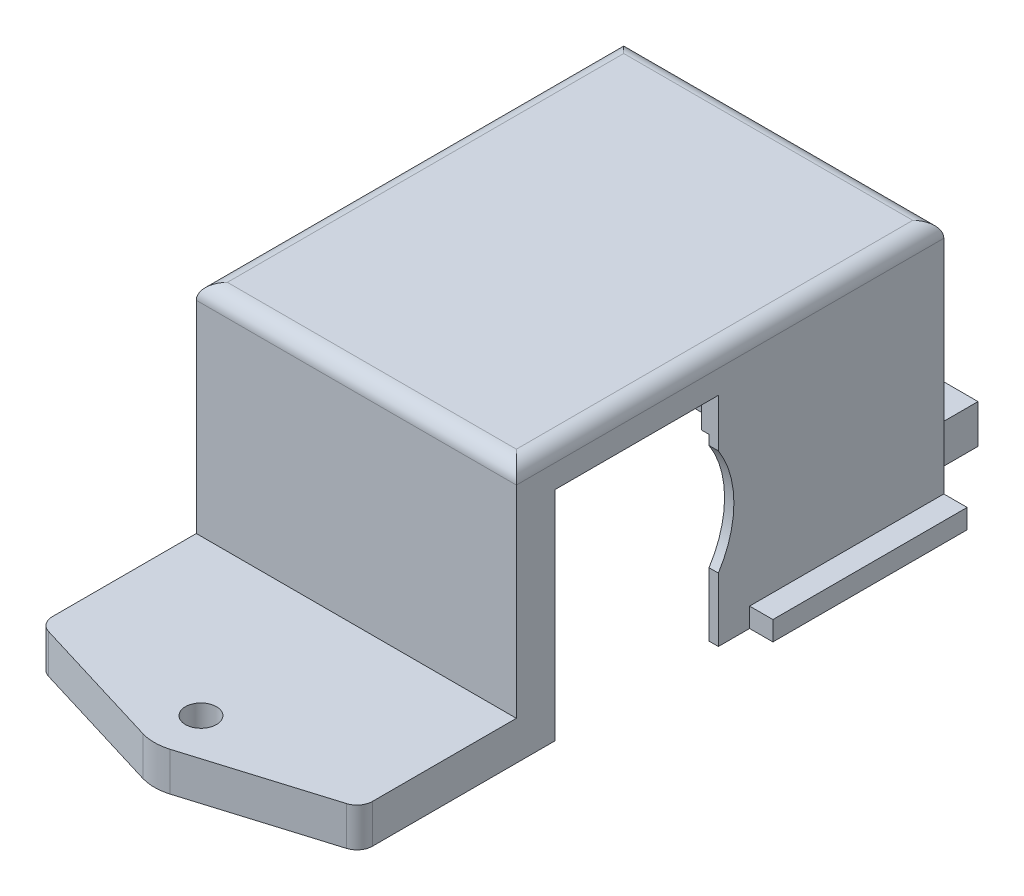
from build123d import *

# Parameters (mm, degrees)
SKETCH1_W            = 39
SKETCH1_H            = 49.22
BOSS_EXTRUDE2_DEPTH  = 30
SKETCH3_W            = 1.75
SKETCH3_H            = 20
SKETCH3_W_2          = 1
SKETCH3_H_2          = 15.1
CUT_EXTRUDE3_DEPTH   = 47.22
CUT_EXTRUDE4_DEPTH   = 47.22
CUT_EXTRUDE5_DEPTH   = 3.75
SKETCH9_W            = 22.2
SKETCH9_H            = 30
CUT_EXTRUDE7_DEPTH   = 61.922592565
SKETCH11_W           = 0.8
SKETCH11_H           = 21.811754546
SKETCH11_H_2         = 8.188245454
CUT_EXTRUDE8_DEPTH   = 46.008146799
SKETCH12_W           = 23
SKETCH12_H           = 2.5
BOSS_EXTRUDE3_DEPTH  = 3
SKETCH13_W           = 23
SKETCH13_H           = 2.5
BOSS_EXTRUDE4_DEPTH  = 3
BOSS_EXTRUDE5_REACH  = 51.909
SKETCH14_W           = 27.02
SKETCH14_H           = 3
SKETCH15_W           = 30.25
SKETCH15_H           = 3
CUT_EXTRUDE9_DEPTH   = 25.02
SKETCH16_W           = 30.25
SKETCH16_H           = 3
CUT_EXTRUDE10_DEPTH  = 46.276919382
SKETCH24_W           = 23
SKETCH24_H           = 2.5
BOSS_EXTRUDE8_DEPTH  = 6
BOSS_EXTRUDE9_DEPTH  = 3
SKETCH26_W           = 41.2
SKETCH26_H           = 27.02
BOSS_EXTRUDE10_DEPTH = 3
SKETCH29_W           = 4.264424859
SKETCH29_H           = 26.447816837
CUT_EXTRUDE14_DEPTH  = 41.905994632
SKETCH30_W           = 3.981396999
SKETCH30_H           = 33.655588154
CUT_EXTRUDE15_DEPTH  = 40.425282457
BOSS_EXTRUDE15_DEPTH = 2
BOSS_EXTRUDE16_DEPTH = 2
SKETCH36_W           = 41.2
SKETCH36_H           = 4.993514727
BOSS_EXTRUDE17_DEPTH = 26
SKETCH37_W           = 41.2
SKETCH37_H           = 5
BOSS_EXTRUDE18_DEPTH = 28.006485273
SKETCH38_W           = 41.2
SKETCH38_H           = 5
BOSS_EXTRUDE19_DEPTH = 20
BOSS_EXTRUDE21_DEPTH = 5
SKETCH40_R           = 2
CUT_EXTRUDE16_DEPTH  = 78.060934741
FILLET1_R            = 2
BOSS_EXTRUDE22_DEPTH = 10


with BuildPart() as part:
    # Sketch1 → Boss-Extrude2 (new body)
    with BuildSketch(Plane(origin=(0, 0, 0), x_dir=(1, 0, 0), z_dir=(0, 1, 0))):
        with Locations((-0.391025069, -11.314396792)):
            Rectangle(SKETCH1_W, SKETCH1_H)
    extrude(amount=BOSS_EXTRUDE2_DEPTH)

    # Sketch3 → Cut-Extrude3 (cut)
    with BuildSketch(Plane.XY.offset(35.924396792)):
        Polygon((16.108974931, 23.05), (16.108974931, 28), (-16.141025069, 28), (-16.141025069, 25.5), (-16.141025069, 5.5), (-16.141025069, 0), (16.108974931, 0), (16.108974931, 7.95), align=None)
        with Locations((-17.016025069, 15.5)):
            Rectangle(SKETCH3_W, SKETCH3_H)
        with Locations((16.608974931, 15.5)):
            Rectangle(SKETCH3_W_2, SKETCH3_H_2)
    extrude(amount=-CUT_EXTRUDE3_DEPTH, mode=Mode.SUBTRACT)

    # Sketch7 → Cut-Extrude4 (cut)
    with BuildSketch(Plane.ZY.offset(19.891025069)):
        with BuildLine():
            ThreePointArc((11.724396792, 15), (24.324396792, 2.4), (36.924396792, 15))
            ThreePointArc((36.924396792, 15), (24.324396792, 27.6), (11.724396792, 15))
        make_face()
    extrude(amount=-CUT_EXTRUDE4_DEPTH, mode=Mode.SUBTRACT)

    # Sketch8 → Cut-Extrude5 (cut)
    with BuildSketch(Plane.ZY.offset(19.891025069)):
        with BuildLine():
            Line((35.924396792, 30), (17.633933867, 30))
            Line((17.633933867, 30), (17.633933867, 27))
            Line((17.633933867, 27), (8.633933867, 27))
            Line((8.633933867, 27), (8.633933867, 4))
            Line((8.633933867, 4), (17.633933867, 4))
            Line((17.633933867, 4), (17.633933867, 0))
            Line((17.633933867, 0), (35.924396792, 0))
            Line((35.924396792, 0), (35.924396792, 10.08065045))
            ThreePointArc((35.924396792, 10.08065045), (11.724396792, 15), (35.924396792, 19.91934955))
            Line((35.924396792, 19.91934955), (35.924396792, 30))
        make_face()
    extrude(amount=-CUT_EXTRUDE5_DEPTH, mode=Mode.SUBTRACT)

    # Sketch9 → Cut-Extrude7 (cut, through all)
    with BuildSketch(Plane(origin=(19.108974931, 0, 0), x_dir=(0, 0, -1), z_dir=(1, 0, 0))):
        with Locations((-24.824396792, 15)):
            Rectangle(SKETCH9_W, SKETCH9_H)
    extrude(amount=-CUT_EXTRUDE7_DEPTH, mode=Mode.SUBTRACT)

    # Sketch11 → Cut-Extrude8 (cut, through all)
    with BuildSketch(Plane.XY.offset(13.724396792)):
        with Locations((18.708974931, 19.094122727)):
            Rectangle(SKETCH11_W, SKETCH11_H)
        with Locations((18.708974931, 4.094122727)):
            Rectangle(SKETCH11_W, SKETCH11_H_2)
    extrude(amount=-CUT_EXTRUDE8_DEPTH, mode=Mode.SUBTRACT)

    # Sketch12 → Boss-Extrude3 (add)
    with BuildSketch(Plane(origin=(18.308974931, 0, 0), x_dir=(0, 0, -1), z_dir=(1, 0, 0))):
        with Locations((1.795603208, 1.25)):
            Rectangle(SKETCH12_W, SKETCH12_H)
    extrude(amount=BOSS_EXTRUDE3_DEPTH)

    # Sketch13 → Boss-Extrude4 (add)
    with BuildSketch(Plane.ZY.offset(19.891025069)):
        with Locations((-1.795603208, 1.25)):
            Rectangle(SKETCH13_W, SKETCH13_H)
    extrude(amount=BOSS_EXTRUDE4_DEPTH)

    # Sketch14 → Boss-Extrude5 (add, up to next)
    with BuildSketch(Plane(origin=(-16.141025069, 0, 0), x_dir=(0, 0, -1), z_dir=(1, 0, 0)), mode=Mode.PRIVATE) as boss_extrude5_sk1:
        with Locations((-0.214396792, 1.5)):
            Rectangle(SKETCH14_W, SKETCH14_H)
    boss_extrude5_tool1 = extrude(boss_extrude5_sk1.sketch, amount=BOSS_EXTRUDE5_REACH, mode=Mode.PRIVATE) - part.part
    add(boss_extrude5_tool1.solids().sort_by_distance((-16.141025, 1.5, 0.214397))[0])

    # Sketch15 → Cut-Extrude9 (cut)
    with BuildSketch(Plane.XY.offset(13.724396792)):
        with Locations((-0.016025069, 1.5)):
            Rectangle(SKETCH15_W, SKETCH15_H)
    extrude(amount=-CUT_EXTRUDE9_DEPTH, mode=Mode.SUBTRACT)

    # Sketch16 → Cut-Extrude10 (cut, through all)
    with BuildSketch(Plane.XY.offset(-11.295603208)):
        with Locations((-0.016025069, 1.5)):
            Rectangle(SKETCH16_W, SKETCH16_H)
    extrude(amount=-CUT_EXTRUDE10_DEPTH, mode=Mode.SUBTRACT)

    # Sketch24 → Boss-Extrude8 (add)
    with BuildSketch(Plane.ZY.offset(22.891025069)):
        with Locations((-1.795603208, 1.25)):
            Rectangle(SKETCH24_W, SKETCH24_H)
    extrude(amount=BOSS_EXTRUDE8_DEPTH)

    # Sketch25 → Boss-Extrude9 (add)
    with BuildSketch(Plane.ZY.offset(19.891025069)):
        Polygon((-13.295603208, 30), (13.724396792, 30), (13.724396792, 27), (8.633933867, 27), (8.633933867, 4), (13.724396792, 4), (13.724396792, 0), (9.704396792, 0), (9.704396792, 2.5), (-13.295603208, 2.5), align=None)
    extrude(amount=BOSS_EXTRUDE9_DEPTH)

    # Sketch26 → Boss-Extrude10 (add)
    with BuildSketch(Plane(origin=(0, 30, 0), x_dir=(1, 0, 0), z_dir=(0, 1, 0))):
        with Locations((-2.291025069, -0.214396792)):
            Rectangle(SKETCH26_W, SKETCH26_H)
    extrude(amount=BOSS_EXTRUDE10_DEPTH)

    # Sketch29 → Cut-Extrude14 (cut, through all)
    with BuildSketch(Plane.XZ.offset(-25.5)):
        with Locations((-15.75881264, 1.92830521)):
            Rectangle(SKETCH29_W, SKETCH29_H)
    extrude(amount=CUT_EXTRUDE14_DEPTH, mode=Mode.SUBTRACT)

    # Sketch30 → Cut-Extrude15 (cut, through all)
    with BuildSketch(Plane(origin=(0, 23.05, 0), x_dir=(-1, 0, 0), z_dir=(0, -1, 0))):
        with Locations((-15.118276432, -5.532190869)):
            Rectangle(SKETCH30_W, SKETCH30_H)
    extrude(amount=CUT_EXTRUDE15_DEPTH, mode=Mode.SUBTRACT)

    # Sketch34 → Boss-Extrude15 (add)
    with BuildSketch(Plane(origin=(0, 0, -13.295603208), x_dir=(-1, 0, 0), z_dir=(0, 0, -1))):
        Polygon((-18.308974931, 33), (-18.308974931, 2.5), (-21.308974931, 2.5), (-21.308974931, 0), (28.891025069, 0), (28.891025069, 2.5), (22.891025069, 2.5), (22.891025069, 33), align=None)
    extrude(amount=-BOSS_EXTRUDE15_DEPTH)

    # Sketch35 → Boss-Extrude16 (add)
    with BuildSketch(Plane(origin=(0, 0, -13.295603208), x_dir=(-1, 0, 0), z_dir=(0, 0, -1))):
        Polygon((-18.308974931, 33), (-18.308974931, 2.5), (-21.308974931, 2.5), (-21.308974931, 0), (28.891025069, 0), (28.891025069, 2.5), (22.891025069, 2.5), (22.891025069, 33), align=None)
    extrude(amount=BOSS_EXTRUDE16_DEPTH)

    # Sketch36 → Boss-Extrude17 (add)
    with BuildSketch(Plane.XY.offset(13.724396792)):
        with Locations((-2.291025069, 30.503242637)):
            Rectangle(SKETCH36_W, SKETCH36_H)
    extrude(amount=BOSS_EXTRUDE17_DEPTH)

    # Sketch37 → Boss-Extrude18 (add)
    with BuildSketch(Plane(origin=(0, 28.006485273, 0), x_dir=(-1, 0, 0), z_dir=(0, -1, 0))):
        with Locations((2.291025069, -37.224396792)):
            Rectangle(SKETCH37_W, SKETCH37_H)
    extrude(amount=BOSS_EXTRUDE18_DEPTH)

    # Sketch38 → Boss-Extrude19 (add)
    with BuildSketch(Plane.XY.offset(39.724396792)):
        with Locations((-2.291025069, 2.5)):
            Rectangle(SKETCH38_W, SKETCH38_H)
    extrude(amount=BOSS_EXTRUDE19_DEPTH)

    # Sketch39 → Boss-Extrude21 (add)
    with BuildSketch(Plane(origin=(0, 5, 0), x_dir=(1, 0, 0), z_dir=(0, 1, 0))):
        with BuildLine():
            Line((-8.291025069, -59.724396792), (-22.891025069, -59.724396792))
            Line((-22.891025069, -59.724396792), (-4.038597885, -65.464256481))
            ThreePointArc((-4.038597885, -65.464256481), (-7.112095329, -63.296130482), (-8.291025069, -59.724396792))
        make_face()
        with BuildLine():
            ThreePointArc((-8.291025069, -59.724396792), (-7.112095329, -63.296130482), (-4.038597885, -65.464256481))
            ThreePointArc((-4.038597885, -65.464256481), (-2.291025069, -65.724396792), (-0.543452254, -65.464256481))
            ThreePointArc((-0.543452254, -65.464256481), (2.53004519, -63.296130482), (3.708974931, -59.724396792))
            Line((3.708974931, -59.724396792), (-0.291025069, -59.724396792))
            ThreePointArc((-0.291025069, -59.724396792), (-2.291025069, -61.724396792), (-4.291025069, -59.724396792))
            Line((-4.291025069, -59.724396792), (-8.291025069, -59.724396792))
        make_face()
        with BuildLine():
            ThreePointArc((3.708974931, -59.724396792), (-2.291025069, -53.724396792), (-8.291025069, -59.724396792))
            Line((-8.291025069, -59.724396792), (-4.291025069, -59.724396792))
            ThreePointArc((-4.291025069, -59.724396792), (-2.291025069, -57.724396792), (-0.291025069, -59.724396792))
            Line((-0.291025069, -59.724396792), (3.708974931, -59.724396792))
        make_face()
        with BuildLine():
            ThreePointArc((3.708974931, -59.724396792), (2.53004519, -63.296130482), (-0.543452254, -65.464256481))
            Line((-0.543452254, -65.464256481), (18.308974931, -59.724396792))
            Line((18.308974931, -59.724396792), (3.708974931, -59.724396792))
        make_face()
    extrude(amount=-BOSS_EXTRUDE21_DEPTH)

    # Sketch40 → Cut-Extrude16 (cut, through all)
    with BuildSketch(Plane(origin=(0, 5, 0), x_dir=(1, 0, 0), z_dir=(0, 1, 0))):
        with Locations(Location((-2.291025069, -59.724396792, 0), (0, 0, 270))):
            Circle(SKETCH40_R)
    extrude(amount=-CUT_EXTRUDE16_DEPTH, mode=Mode.SUBTRACT)

    # Fillet1
    fillet1_edges = [part.edges().sort_by_distance(p)[0] for p in [
        (-22.891025069, 33, 12.214396792),
        (18.308974931, 33, 12.214396792),
        (-2.291025069, 33, -15.295603208),
        (-2.291025069, 33, 39.724396792),
        (-22.891025069, 2.5, 59.724396792),
        (18.308974931, 2.5, 59.724396792),
    ]]
    fillet(fillet1_edges, radius=FILLET1_R)

    # Sketch41 → Boss-Extrude22 (add)
    with BuildSketch(Plane(origin=(0, 0, -15.295603208), x_dir=(-1, 0, 0), z_dir=(0, 0, -1))):
        Polygon((17.291025069, 5), (2.291025069, 5), (-12.708974931, 5), (-12.708974931, 0), (2.291025069, 0), (17.291025069, 0), align=None)
    extrude(amount=BOSS_EXTRUDE22_DEPTH)


solid = part.part
